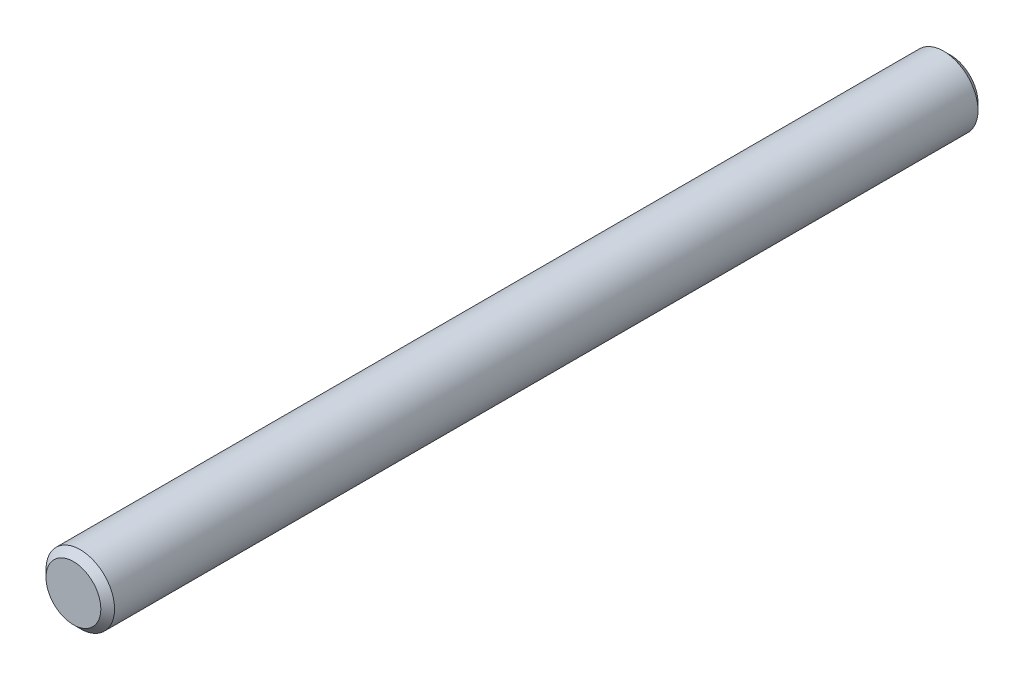
from build123d import *

# Parameters (mm, degrees)
SKETCH3_R           = 7.9375
BOSS_EXTRUDE1_DEPTH = 101.6
CHAMFER1_SIZE       = 1.5875


with BuildPart() as part:
    # Sketch3 → Boss-Extrude1 (new, symmetric)
    with BuildSketch(Plane.XY):
        Circle(SKETCH3_R)
    extrude(amount=BOSS_EXTRUDE1_DEPTH, both=True)

    # Chamfer1
    chamfer1_edges = [part.edges().sort_by_distance(p)[0] for p in [
        (-7.9375, 0, -101.6),
        (-7.9375, 0, 101.6),
    ]]
    chamfer(chamfer1_edges, length=CHAMFER1_SIZE)


solid = part.part
